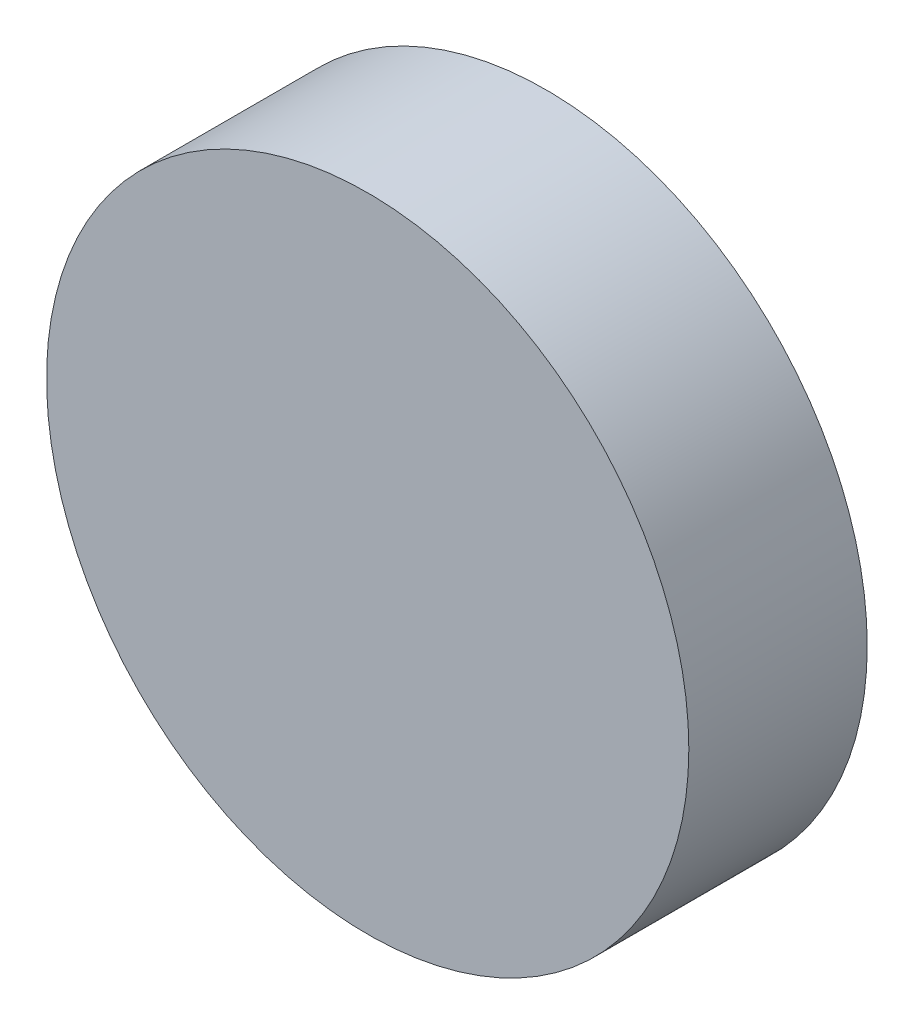
from build123d import *

# Parameters (mm, degrees)
SKETCH1_R           = 9
BOSS_EXTRUDE1_DEPTH = 5


with BuildPart() as part:
    # Sketch1 → Boss-Extrude1 (new body)
    with BuildSketch(Plane.XY):
        Circle(SKETCH1_R)
    extrude(amount=BOSS_EXTRUDE1_DEPTH)


solid = part.part
